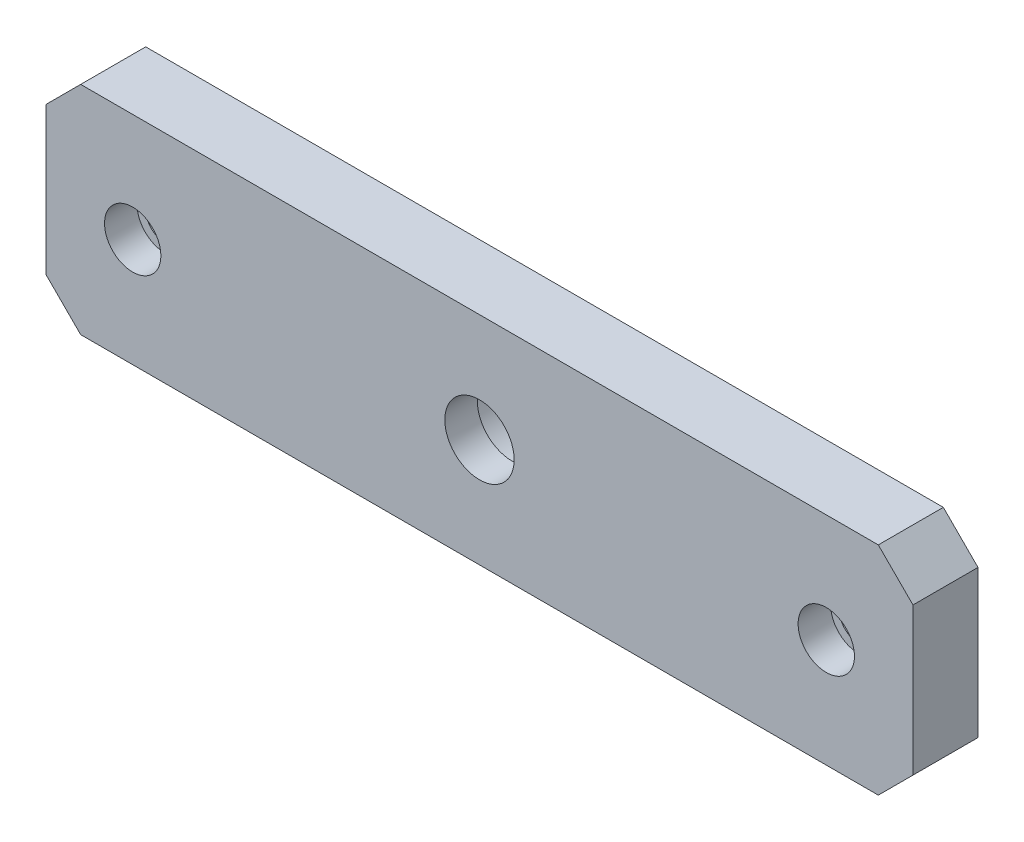
from build123d import *

# Parameters (mm, degrees)
SKETCH_1_W          = 200
SKETCH_1_H          = 50
EXTRUDE_1_DEPTH     = 15
SKETCH_2_R          = 4.5
SKETCH_2_R_2        = 8
CUT_EXTRUDE_1_DEPTH = 207.700266086
SKETCH_5_R          = 6.5
CUT_EXTRUDE_4_DEPTH = 7.5
SKETCH_6_R          = 12
CUT_EXTRUDE_5_DEPTH = 7.5
CHAMFER_1_SIZE      = 8


with BuildPart() as part:
    # 草图1 → 凸台-拉伸1 (new body)
    with BuildSketch(Plane.XY):
        with Locations((100, 25)):
            Rectangle(SKETCH_1_W, SKETCH_1_H)
    extrude(amount=EXTRUDE_1_DEPTH)

    # 草图2 → 切除-拉伸1 (cut, through all)
    with BuildSketch(Plane.XY.offset(15)):
        with Locations((20, 25)):
            Circle(SKETCH_2_R)
        with Locations((100, 25)):
            Circle(SKETCH_2_R_2)
        with Locations((180, 25)):
            Circle(SKETCH_2_R)
    extrude(amount=-CUT_EXTRUDE_1_DEPTH, mode=Mode.SUBTRACT)

    # 草图5 → 切除-拉伸4 (cut)
    with BuildSketch(Plane.XY.offset(15)):
        with Locations((20, 25)):
            Circle(SKETCH_5_R)
        with Locations((180, 25)):
            Circle(SKETCH_5_R)
    extrude(amount=-CUT_EXTRUDE_4_DEPTH, mode=Mode.SUBTRACT)

    # 草图6 → 切除-拉伸5 (cut)
    with BuildSketch(Plane(origin=(0, 0, 0), x_dir=(-1, 0, 0), z_dir=(0, 0, -1))):
        with Locations((-100, 25)):
            Circle(SKETCH_6_R)
    extrude(amount=-CUT_EXTRUDE_5_DEPTH, mode=Mode.SUBTRACT)

    # 倒角1
    chamfer_1_edges = [part.edges().sort_by_distance(p)[0] for p in [
        (0, 50, 7.5),
        (200, 50, 7.5),
        (200, 0, 7.5),
        (0, 0, 7.5),
    ]]
    chamfer(chamfer_1_edges, length=CHAMFER_1_SIZE)


solid = part.part
